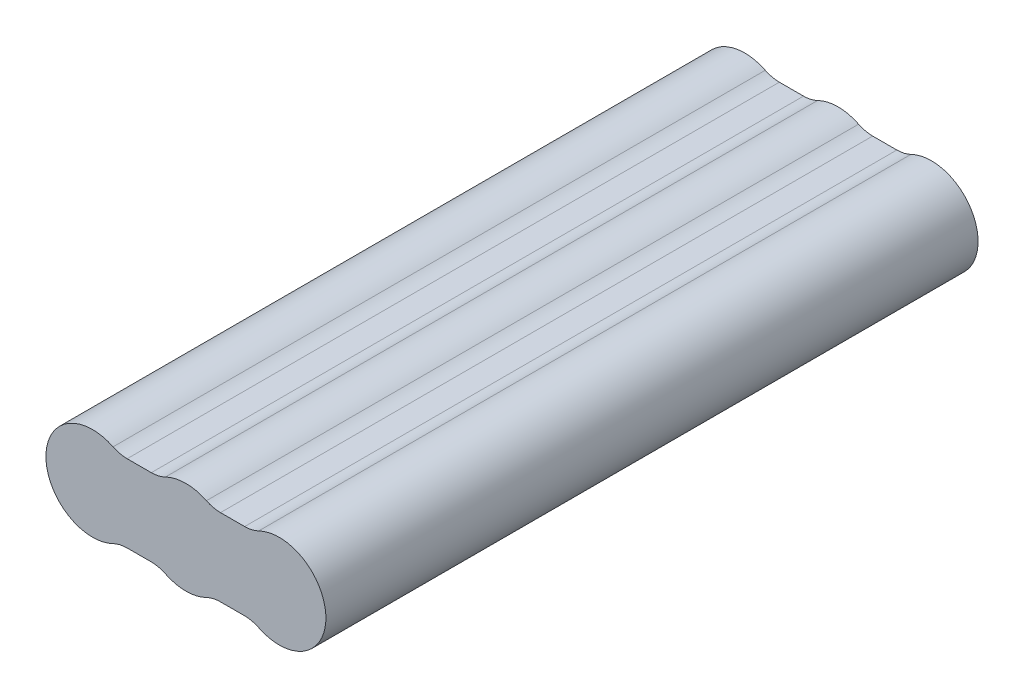
from build123d import *

# Parameters (mm, degrees)
BOSS_EXTRUDE1_DEPTH = 129.3114


with BuildPart() as part:
    # Sketch1 → Boss-Extrude1 (new body)
    with BuildSketch(Plane.XY):
        with BuildLine():
            Line((3220.750449704, 2866.97511019), (3225.540701758, 2866.97511019))
            ThreePointArc((3225.540701758, 2866.97511019), (3226.972975907, 2867.138746899), (3228.331431905, 2867.621223336))
            ThreePointArc((3228.331431905, 2867.621223336), (3232.397525731, 2868.56261019), (3236.463619556, 2867.621223336))
            ThreePointArc((3236.463619556, 2867.621223336), (3237.822075555, 2867.138746899), (3239.254349704, 2866.97511019))
            Line((3239.254349704, 2866.97511019), (3244.044601758, 2866.97511019))
            ThreePointArc((3244.044601758, 2866.97511019), (3245.476875907, 2867.138746899), (3246.835331905, 2867.621223336))
            ThreePointArc((3246.835331905, 2867.621223336), (3260.153375731, 2859.31066019), (3246.835331905, 2851.000097044))
            ThreePointArc((3246.835331905, 2851.000097044), (3245.476875907, 2851.48257348), (3244.044601758, 2851.64621019))
            Line((3244.044601758, 2851.64621019), (3239.254349704, 2851.64621019))
            ThreePointArc((3239.254349704, 2851.64621019), (3237.822075555, 2851.48257348), (3236.463619556, 2851.000097044))
            ThreePointArc((3236.463619556, 2851.000097044), (3232.397525731, 2850.05871019), (3228.331431905, 2851.000097044))
            ThreePointArc((3228.331431905, 2851.000097044), (3226.972975907, 2851.48257348), (3225.540701758, 2851.64621019))
            Line((3225.540701758, 2851.64621019), (3220.750449704, 2851.64621019))
            ThreePointArc((3220.750449704, 2851.64621019), (3219.318175555, 2851.48257348), (3217.959719556, 2851.000097044))
            ThreePointArc((3217.959719556, 2851.000097044), (3204.641675731, 2859.31066019), (3217.959719556, 2867.621223336))
            ThreePointArc((3217.959719556, 2867.621223336), (3219.318175555, 2867.138746899), (3220.750449704, 2866.97511019))
        make_face()
    extrude(amount=BOSS_EXTRUDE1_DEPTH)


solid = part.part
